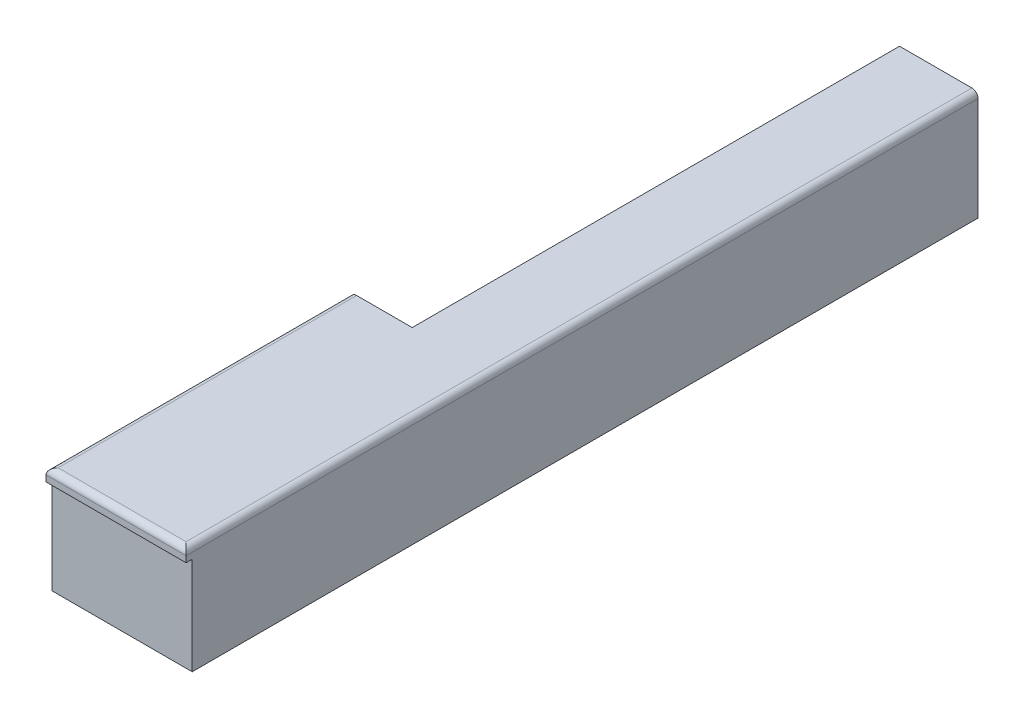
from build123d import *

# Parameters (mm, degrees)
SALIENTE_EXTRUIR1_DEPTH = 18
CROQUIS4_W              = 23
CROQUIS4_H              = 16
CORTAR_EXTRUIR1_DEPTH   = 1
REDONDEO1_R             = 1


with BuildPart() as part:
    # Croquis2 → Saliente-Extruir1 (new body)
    with BuildSketch(Plane(origin=(0, 0, 0), x_dir=(1, 0, 0), z_dir=(0, 1, 0))):
        Polygon((0, 50), (0, 0), (23, 0), (23, 50), (23, 130), (10.12, 130), (10.12, 50), align=None)
    extrude(amount=SALIENTE_EXTRUIR1_DEPTH)

    # Croquis4 → Cortar-Extruir1 (cut)
    with BuildSketch(Plane.XY):
        with Locations((11.5, 8)):
            Rectangle(CROQUIS4_W, CROQUIS4_H)
    extrude(amount=-CORTAR_EXTRUIR1_DEPTH, mode=Mode.SUBTRACT)

    # Redondeo1
    redondeo1_edges = [part.edges().sort_by_distance(p)[0] for p in [
        (0, 18, -25),
        (11.5, 18, 0),
        (23, 18, -65),
    ]]
    fillet(redondeo1_edges, radius=REDONDEO1_R)


solid = part.part
